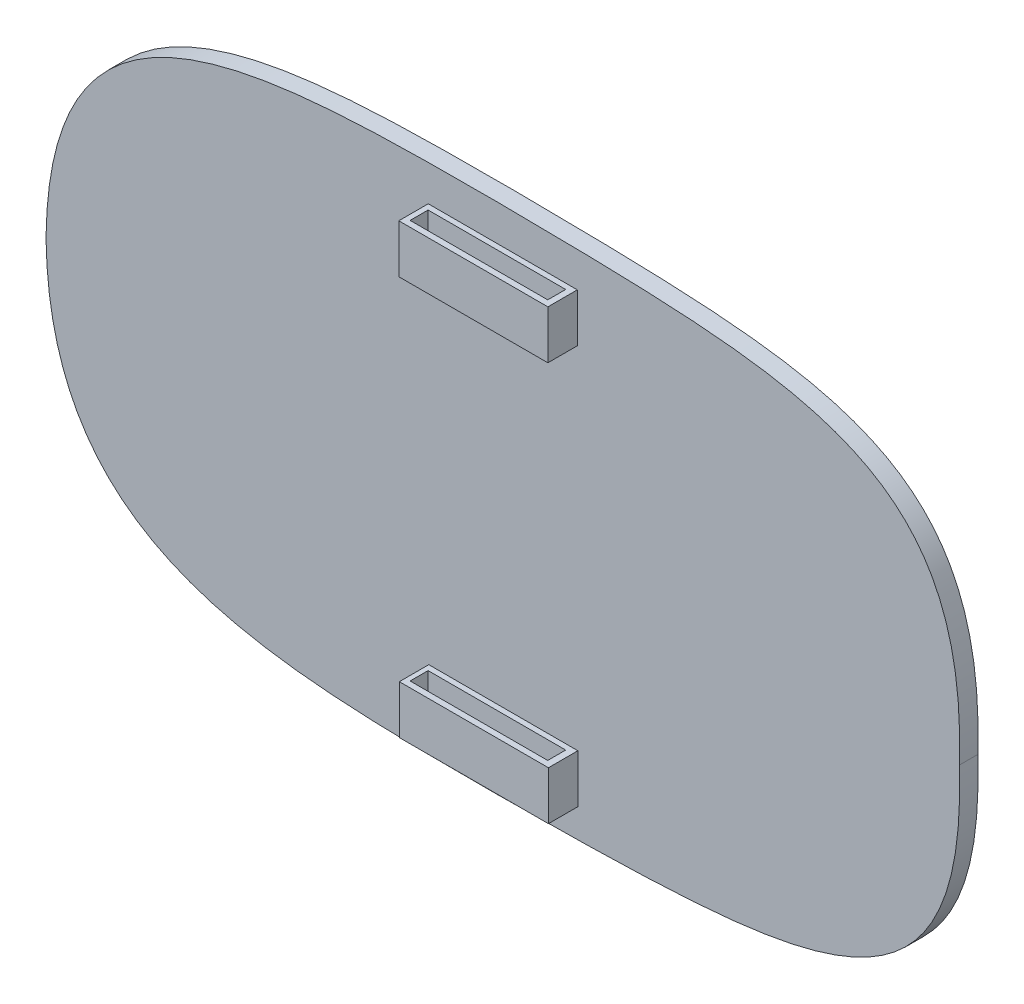
from build123d import *

# Parameters (mm, degrees)
BOSS_EXTRUDE1_DEPTH     = 2.5
SKETCH4_R               = 2.75
CUT_EXTRUDE1_DEPTH      = 1.7
SKETCH6_W               = 20.25477878
SKETCH6_H               = 6.584524734
BOSS_EXTRUDE2_DEPTH     = 4
SKETCH7_W               = 20.25477878
SKETCH7_H               = 6.584524734
BOSS_EXTRUDE3_DEPTH     = 4
CUT_EXTRUDE2_DEPTH      = 53
CUT_EXTRUDE2_DEPTH_BACK = 44
SKETCH8_W               = 18.696515829
SKETCH8_H               = 2.443988997


with BuildPart() as part:
    # Sketch3 → Boss-Extrude1 (new body)
    with BuildSketch(Plane.XY):
        with BuildLine():
            add(Edge.make_bspline(
                [(-62.064505272, -0.004637852), (-61.621909117, -32.5598919), (-30.174527466, -35.195991578), (40.855407495, -34.494653581), (63.068334921, -31.044513609), (62.04382147, -0.004637852)],
                knots=[0, 0, 0, 0, 0.421952335, 0.521952335, 1, 1, 1, 1], degree=3))
            add(Edge.make_bspline(
                [(-62.064505272, -0.004637852), (-61.621909117, 32.550616197), (-30.174527466, 35.186715874), (40.855407495, 34.485377878), (63.068334921, 31.035237905), (62.04382147, -0.004637852)],
                knots=[0, 0, 0, 0, 0.421952335, 0.521952335, 1, 1, 1, 1], degree=3))
        make_face()
    extrude(amount=BOSS_EXTRUDE1_DEPTH)

    # Sketch4 → Cut-Extrude1 (cut)
    with BuildSketch(Plane.XY):
        with Locations((51.009218897, 21.808375926)):
            Circle(SKETCH4_R)
        with Locations((-55.286211949, 0)):
            Circle(SKETCH4_R)
        with Locations((52.862963879, -19.182859298)):
            Circle(SKETCH4_R)
    extrude(amount=CUT_EXTRUDE1_DEPTH, mode=Mode.SUBTRACT)

    # Sketch6 → Boss-Extrude2 (add)
    with BuildSketch(Plane.XY.offset(2.5)):
        with Locations((0, 26.662687323)):
            Rectangle(SKETCH6_W, SKETCH6_H)
    extrude(amount=BOSS_EXTRUDE2_DEPTH)

    # Sketch7 → Boss-Extrude3 (add)
    with BuildSketch(Plane.XY.offset(2.5)):
        with Locations((0.073481457, -27.534120602)):
            Rectangle(SKETCH7_W, SKETCH7_H)
    extrude(amount=BOSS_EXTRUDE3_DEPTH)

    # Sketch8 → Cut-Extrude2 (cut, two sides: drawn at the far end of the back side and taken through both)
    with BuildSketch(Plane(origin=(0, 0, 0), x_dir=(1, 0, 0), z_dir=(0, 1, 0)).offset(-CUT_EXTRUDE2_DEPTH_BACK)):
        with Locations((-0.05486909, -4.466718934)):
            Rectangle(SKETCH8_W, SKETCH8_H)
    extrude(amount=CUT_EXTRUDE2_DEPTH + CUT_EXTRUDE2_DEPTH_BACK, mode=Mode.SUBTRACT)


solid = part.part
